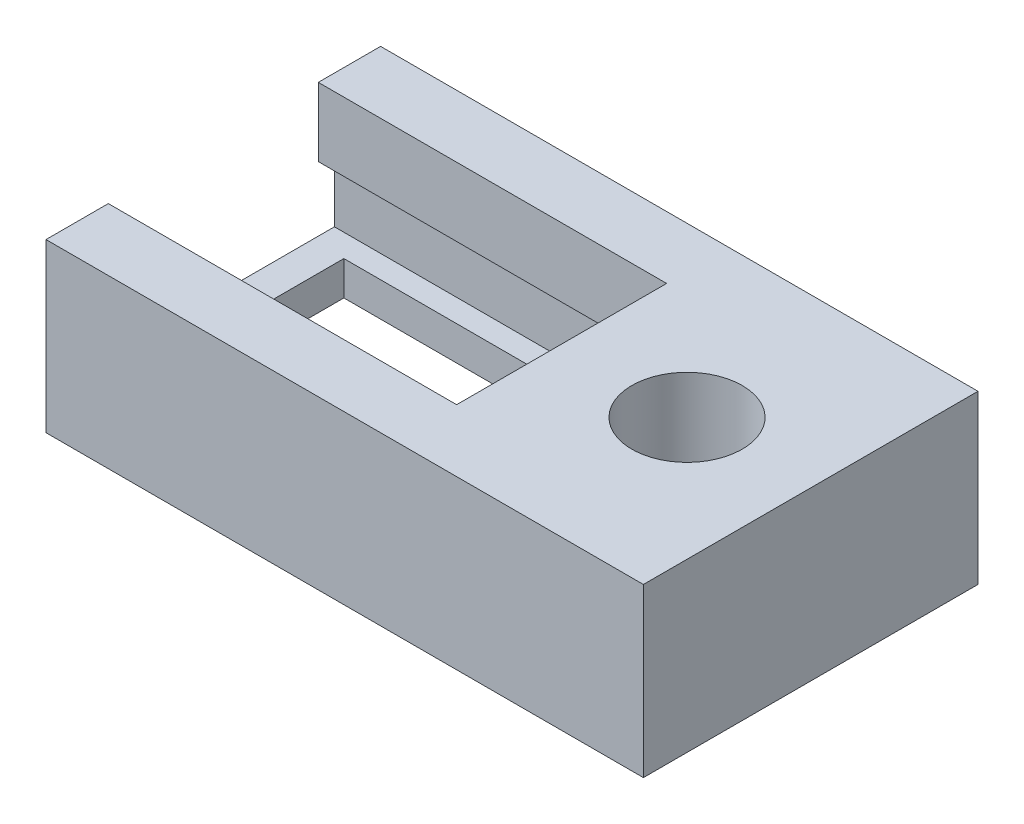
from build123d import *

# Parameters (mm, degrees)
SKETCH2_W           = 17.853706718
SKETCH2_H           = 10
BOSS_EXTRUDE2_DEPTH = 5
SKETCH4_W           = 7.1
SKETCH4_H           = 1.928064037
CUT_EXTRUDE1_DEPTH  = 9.3
CUT_EXTRUDE4_START  = 1.02
SKETCH6_W           = 15.11279267
SKETCH6_H           = 6.275441998
CUT_EXTRUDE4_DEPTH  = 9.3
SKETCH7_R           = 1.65
CUT_EXTRUDE7_DEPTH  = 17.583123952
SKETCH9_W           = 9.168085379
SKETCH9_H           = 5.824430712
CUT_EXTRUDE8_DEPTH  = 17.304612844


with BuildPart() as part:
    # Sketch2 → Boss-Extrude2 (new body)
    with BuildSketch(Plane(origin=(0, 0, 0), x_dir=(1, 0, 0), z_dir=(0, 1, 0))):
        with Locations((6.073146641, 0)):
            Rectangle(SKETCH2_W, SKETCH2_H)
    extrude(amount=BOSS_EXTRUDE2_DEPTH)

    # Sketch4 → Cut-Extrude1 (cut)
    with BuildSketch(Plane.ZY.offset(2.853706718)):
        with Locations((-0.07, 1.984032018)):
            Rectangle(SKETCH4_W, SKETCH4_H)
    extrude(amount=-CUT_EXTRUDE1_DEPTH, mode=Mode.SUBTRACT)

    # Sketch6 → Cut-Extrude4 (cut)
    with BuildSketch(Plane(origin=(0, 0, 0), x_dir=(1, 0, 0), z_dir=(0, 1, 0)).offset(CUT_EXTRUDE4_START)):
        Rectangle(SKETCH6_W, SKETCH6_H)
    extrude(amount=CUT_EXTRUDE4_DEPTH, mode=Mode.SUBTRACT)

    # Sketch7 → Cut-Extrude7 (cut, through all)
    with BuildSketch(Plane.XZ):
        with Locations(Location((11.326869327, 0.023099137, 0), (0, 0, 270))):
            Circle(SKETCH7_R)
    extrude(amount=-CUT_EXTRUDE7_DEPTH, mode=Mode.SUBTRACT)

    # Sketch9 → Cut-Extrude8 (cut, through all)
    with BuildSketch(Plane(origin=(0, 1.02, 0), x_dir=(1, 0, 0), z_dir=(0, 1, 0))):
        with Locations((2.693538698, 0.026964957)):
            Rectangle(SKETCH9_W, SKETCH9_H)
    extrude(amount=-CUT_EXTRUDE8_DEPTH, mode=Mode.SUBTRACT)


solid = part.part
